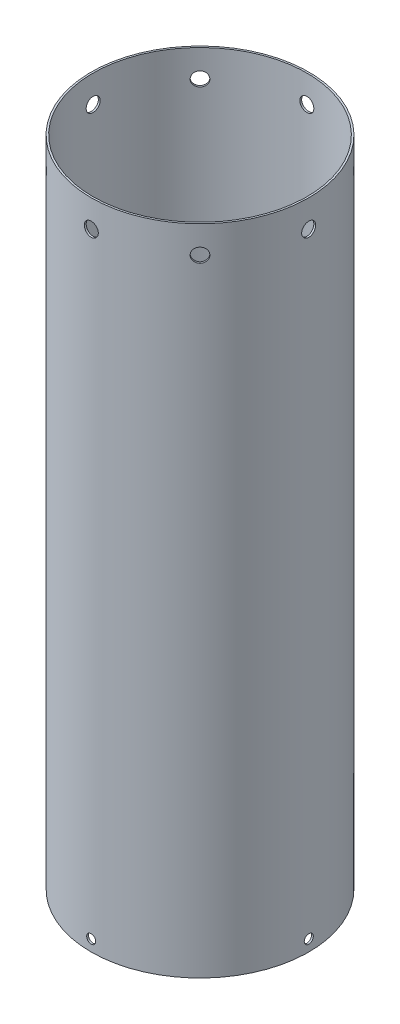
from build123d import *

# Parameters (mm, degrees)
SKETCH1_R           = 76.2
BOSS_EXTRUDE1_DEPTH = 457.2
SKETCH2_R           = 74.93
CUT_EXTRUDE1_DEPTH  = 470.728347026
SKETCH3_R           = 4.8895
CUT_EXTRUDE2_DEPTH  = 470.728347026
CIRPATTERN1_COUNT   = 8
SKETCH4_R           = 3.175
CUT_EXTRUDE3_DEPTH  = 470.728347156
CIRPATTERN2_COUNT   = 4


with BuildPart() as part:
    # Sketch1 → Boss-Extrude1 (new body)
    with BuildSketch(Plane(origin=(0, 0, 0), x_dir=(1, 0, 0), z_dir=(0, 1, 0))):
        with Locations(Location((0, 0, 0), (0, 0, 270))):
            Circle(SKETCH1_R)
    extrude(amount=BOSS_EXTRUDE1_DEPTH)

    # Sketch2 → Cut-Extrude1 (cut, through all)
    with BuildSketch(Plane(origin=(0, 457.2, 0), x_dir=(1, 0, 0), z_dir=(0, 1, 0))):
        with Locations(Location((0, 0, 0), (0, 0, 270))):
            Circle(SKETCH2_R)
    extrude(amount=-CUT_EXTRUDE1_DEPTH, mode=Mode.SUBTRACT)

    # Sketch3 → Cut-Extrude2 (cut, symmetric)
    with BuildSketch(Plane.XY):
        with Locations((0, 438.15)):
            Circle(SKETCH3_R)
    cut_extrude2 = extrude(amount=CUT_EXTRUDE2_DEPTH, both=True, mode=Mode.SUBTRACT)

    # CirPattern1: Cut-Extrude2 ×8 about axis
    cirpattern1_axis = Axis((0, 457.2, 0), (0, -1, 0))
    for i in range(1, CIRPATTERN1_COUNT):
        add(cut_extrude2.rotate(cirpattern1_axis, i * 360 / CIRPATTERN1_COUNT), mode=Mode.SUBTRACT)

    # Sketch4 → Cut-Extrude3 (cut, symmetric)
    with BuildSketch(Plane.XY):
        with Locations((0, 7.9375)):
            Circle(SKETCH4_R)
    cut_extrude3 = extrude(amount=CUT_EXTRUDE3_DEPTH, both=True, mode=Mode.SUBTRACT)

    # CirPattern2: Cut-Extrude3 ×4 about axis
    cirpattern2_axis = Axis((0, 457.2, 0), (0, -1, 0))
    for i in range(1, CIRPATTERN2_COUNT):
        add(cut_extrude3.rotate(cirpattern2_axis, i * 360 / CIRPATTERN2_COUNT), mode=Mode.SUBTRACT)


solid = part.part
